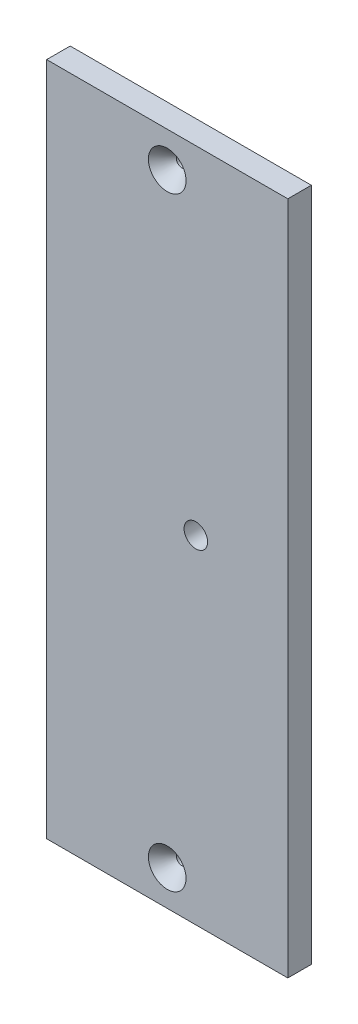
from build123d import *

# Parameters (mm, degrees)
SKETCH1_W                   = 65.087862113
SKETCH1_H                   = 182.149999994
BOSS_EXTRUDE1_DEPTH         = 6.35
F_1_4_0_25_DIAMETER_HOLE1_D = 6.35
HOLE1_D                     = 3.175
HOLE1_DEPTH                 = 31.75
HOLE1_CSINK_D               = 10.16
HOLE1_CSINK_ANGLE           = 82
HOLE1_TIP                   = 0.953866233


with BuildPart() as part:
    # Sketch1 → Boss-Extrude1 (new body)
    with BuildSketch(Plane.XY):
        with Locations((-267.296898237, -72.024999997)):
            Rectangle(SKETCH1_W, SKETCH1_H)
    extrude(amount=BOSS_EXTRUDE1_DEPTH)

    # 1/4 (0.25) Diameter Hole1 (through all)
    with Locations(Plane.XY.offset(6.35)):
        with Locations((-259.576391655, -72.024999997)):
            Hole(F_1_4_0_25_DIAMETER_HOLE1_D / 2)

    # Hole1
    with Locations(Plane(origin=(181.039434513, -72.024999997, 6.35), x_dir=(0, 1, 0), z_dir=(0, 0, 1))):
        with Locations((81.549999997, 448.336332751), (-81.549999997, 448.336332751)):
            CounterSinkHole(HOLE1_D / 2, HOLE1_CSINK_D / 2, depth=HOLE1_DEPTH, counter_sink_angle=HOLE1_CSINK_ANGLE)
            with Locations((0, 0, -(HOLE1_DEPTH + HOLE1_TIP / 2))):  # 118° drill point
                Cone(0, HOLE1_D / 2, HOLE1_TIP, mode=Mode.SUBTRACT)


solid = part.part
